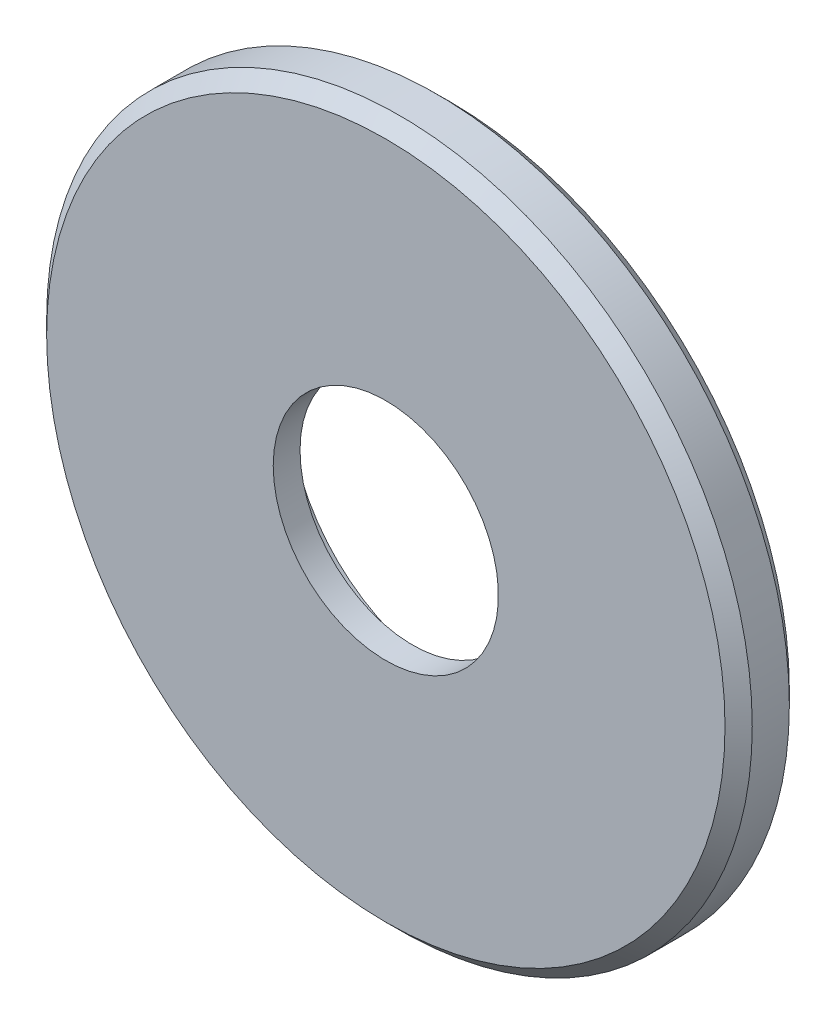
from build123d import *

# Parameters (mm, degrees)
ESQUISSE1_R             = 65.794178673
BOSS_EXTRU_1_DEPTH      = 12
CONG_1_SIZE             = 2.54
ESQUISSE4_R             = 10.5
ENL_V_MAT_EXTRU_2_DEPTH = 5
ESQUISSE2_R             = 21
ENL_V_MAT_EXTRU_4_DEPTH = 94.817631043
ESQUISSE5_R             = 30
ENL_V_MAT_EXTRU_5_DEPTH = 7


with BuildPart() as part:
    # Esquisse1 → Boss.-Extru.1 (new body)
    with BuildSketch(Plane.XY):
        Circle(ESQUISSE1_R)
    extrude(amount=BOSS_EXTRU_1_DEPTH)

    # Congé1
    cong_1_edges = [part.edges().sort_by_distance(p)[0] for p in [
        (-65.794178673, 0, 0),
        (-65.794178673, 0, 12),
    ]]
    chamfer(cong_1_edges, length=CONG_1_SIZE)

    # Esquisse4 → Enlèv. mat.-Extru.2 (cut)
    with BuildSketch(Plane(origin=(0, 0, 0), x_dir=(-1, 0, 0), z_dir=(0, 0, -1))):
        with Locations((0.551144242, 48.355572121)):
            Circle(ESQUISSE4_R)
        with Locations((42.152725992, 23.700481146)):
            Circle(ESQUISSE4_R)
        with Locations((41.60158175, -24.655090975)):
            Circle(ESQUISSE4_R)
        with Locations((-0.551144242, -48.355572121)):
            Circle(ESQUISSE4_R)
        with Locations((-42.152725992, -23.700481146)):
            Circle(ESQUISSE4_R)
        with Locations((-41.60158175, 24.655090975)):
            Circle(ESQUISSE4_R)
    extrude(amount=-ENL_V_MAT_EXTRU_2_DEPTH, mode=Mode.SUBTRACT)

    # Esquisse2 → Enlèv. mat.-Extru.4 (cut, through all)
    with BuildSketch(Plane(origin=(0, 0, 0), x_dir=(-1, 0, 0), z_dir=(0, 0, -1))):
        Circle(ESQUISSE2_R)
    extrude(amount=-ENL_V_MAT_EXTRU_4_DEPTH, mode=Mode.SUBTRACT)

    # Esquisse5 → Enlèv. mat.-Extru.5 (cut)
    with BuildSketch(Plane(origin=(0, 0, 0), x_dir=(-1, 0, 0), z_dir=(0, 0, -1))):
        Circle(ESQUISSE5_R)
    extrude(amount=-ENL_V_MAT_EXTRU_5_DEPTH, mode=Mode.SUBTRACT)


solid = part.part
